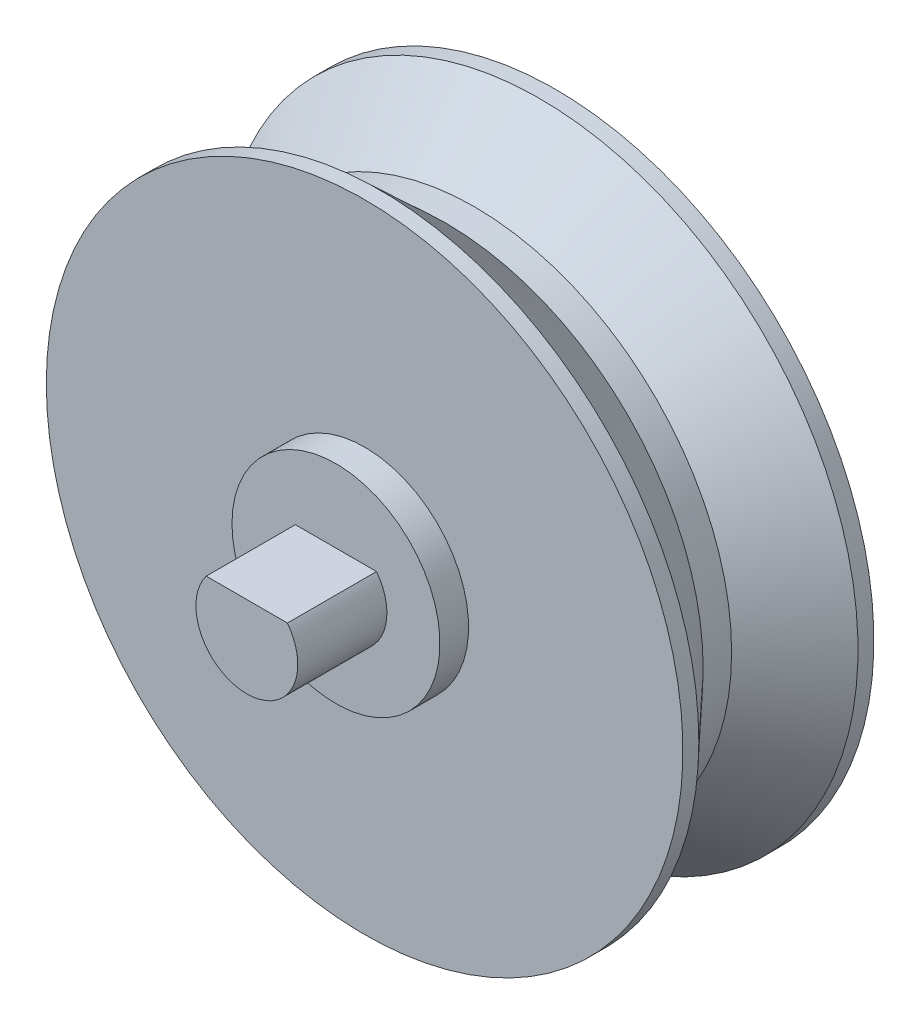
from build123d import *

# Parameters (mm, degrees)
EXTRUDE_1_DEPTH      = 40
SKETCH_2_R           = 9.8
EXTRUDE_2_DEPTH      = 23.4
EXTRUDE_3_DEPTH      = 9
EXTRUDE_3_DEPTH_BACK = 9
SKETCH_3_R           = 30
EXTRUDE_4_DEPTH      = 2
EXTRUDE_4_DEPTH_BACK = 2
SKETCH_5_R           = 24.25


with BuildPart() as part:
    # 스케치1 → 보스-돌출1 (new body)
    with BuildSketch(Plane.XY):
        with BuildLine():
            Line((3.8249183, 2.9), (-3.8249183, 2.9))
            ThreePointArc((-3.8249183, 2.9), (-1.529769944, -4.549703718), (4.8, 0))
            ThreePointArc((4.8, 0), (4.549703718, 1.529769944), (3.8249183, 2.9))
        make_face()
    extrude(amount=EXTRUDE_1_DEPTH)

    # 스케치2 → 보스-돌출2 (add)
    with BuildSketch(Plane(origin=(0, 0, 8.2), x_dir=(-1, 0, 0), z_dir=(0, 0, -1))):
        Circle(SKETCH_2_R)
    extrude(amount=-EXTRUDE_2_DEPTH)

    # 스케치3 → 보스-돌출3 (add, two sides: drawn at the far end of the back side and taken through both)
    with BuildSketch(Plane(origin=(0, 0, 19.9), x_dir=(-1, 0, 0), z_dir=(0, 0, -1)).offset(-EXTRUDE_3_DEPTH_BACK)):
        Circle(SKETCH_3_R)
    extrude(amount=EXTRUDE_3_DEPTH + EXTRUDE_3_DEPTH_BACK)

    # 스케치4 → 컷-회전1 (revolve, cut)
    with BuildSketch(Plane(origin=(0, 0, 0), x_dir=(0, 0, -1), z_dir=(1, 0, 0)), mode=Mode.PRIVATE) as cut_revolve_1_sk:
        Polygon((-19.9, 23), (-12.4, 30), (-27.4, 30), align=None)
    revolve(cut_revolve_1_sk.sketch.rotate(Axis((0, 0, -4.267978706), (0, 0, 1)), 90), axis=Axis((0, 0, -4.267978706), (0, 0, 1)), mode=Mode.SUBTRACT)

    # 스케치5 → 보스-돌출4 (add, two sides: drawn at the far end of the back side and taken through both)
    with BuildSketch(Plane(origin=(0, 0, 19.9), x_dir=(-1, 0, 0), z_dir=(0, 0, -1)).offset(-EXTRUDE_4_DEPTH_BACK)):
        Circle(SKETCH_5_R)
    extrude(amount=EXTRUDE_4_DEPTH + EXTRUDE_4_DEPTH_BACK)


solid = part.part
